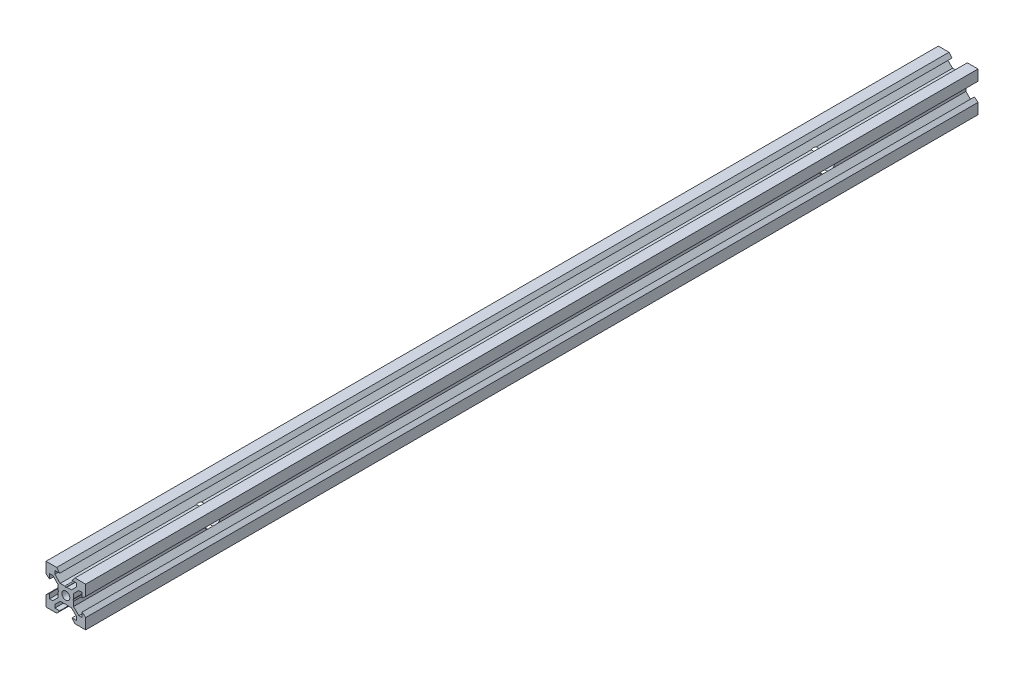
from build123d import *

# Parameters (mm, degrees)
SKETCH1_R           = 2
BOSS_EXTRUDE1_DEPTH = 450
SKETCH2_R           = 4.1
CUT_EXTRUDE1_DEPTH  = 451.325671043


with BuildPart() as part:
    # Sketch1 → Boss-Extrude1 (new body)
    with BuildSketch(Plane.XY):
        Polygon((10, 10), (10, 4.610379336), (8.2, 3.1), (8.2, 5.5), (6.560660172, 5.5), (3.9, 2.839339828), (3.9, 0.519615242), (3.6, 0), (3.9, -0.519615242), (3.9, -2.839339828), (6.560660172, -5.5), (8.2, -5.5), (8.2, -3.1), (10, -4.610379336), (10, -10), (4.610379336, -10), (3.1, -8.2), (5.5, -8.2), (5.5, -6.560660172), (2.839339828, -3.9), (0.519615242, -3.9), (0, -3.6), (-0.519615242, -3.9), (-2.839339828, -3.9), (-5.5, -6.560660172), (-5.5, -8.2), (-3.1, -8.2), (-4.610379336, -10), (-10, -10), (-10, -4.610379336), (-8.2, -3.1), (-8.2, -5.5), (-6.560660172, -5.5), (-3.9, -2.839339828), (-3.9, -0.519615242), (-3.6, 0), (-3.9, 0.519615242), (-3.9, 2.839339828), (-6.560660172, 5.5), (-8.2, 5.5), (-8.2, 3.1), (-10, 4.610379336), (-10, 10), (-4.610379336, 10), (-3.1, 8.2), (-5.5, 8.2), (-5.5, 6.560660172), (-2.839339828, 3.9), (-0.519615242, 3.9), (0, 3.6), (0.519615242, 3.9), (2.839339828, 3.9), (5.5, 6.560660172), (5.5, 8.2), (3.1, 8.2), (4.610379336, 10), align=None)
        Circle(SKETCH1_R, mode=Mode.SUBTRACT)
    extrude(amount=BOSS_EXTRUDE1_DEPTH)

    # Sketch2 → Cut-Extrude1 (cut, through all)
    with BuildSketch(Plane(origin=(3.9, 0, 0), x_dir=(0, 0, -1), z_dir=(1, 0, 0))):
        with Locations(Location((-380, 0, 0), (0, 0, 136.169927123))):
            Circle(SKETCH2_R)
        with Locations(Location((-70, 0, 0), (0, 0, 136.169927123))):
            Circle(SKETCH2_R)
    extrude(amount=-CUT_EXTRUDE1_DEPTH, mode=Mode.SUBTRACT)


solid = part.part
